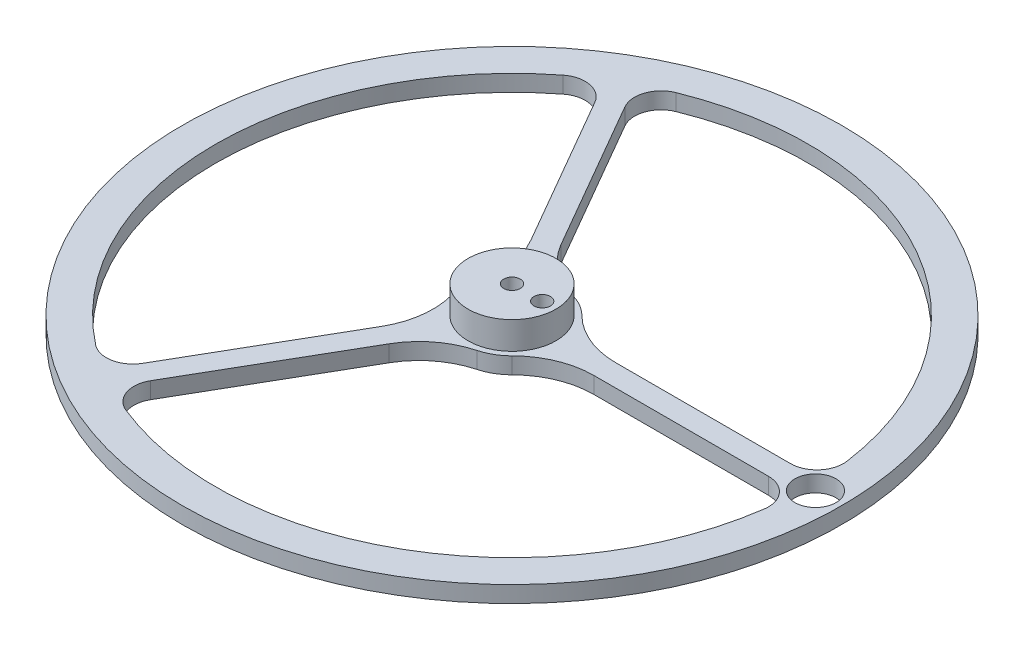
from build123d import *

# Parameters (mm, degrees)
SKETCH1_R               = 60
SKETCH1_R_2             = 54
BOSS_EXTRUDE1_DEPTH     = 3
SKETCH2_R               = 9
BOSS_EXTRUDE2_DEPTH     = 3
SKETCH3_R               = 8
BOSS_EXTRUDE3_DEPTH     = 5
BOSS_EXTRUDE4_DEPTH     = 3
CIRPATTERN9_COUNT       = 3
MIRROR2_COPY_1_DEPTH    = 3
MIRROR2_COPY_2_DEPTH    = 3
SKETCH5_R               = 1.5
CUT_EXTRUDE1_DEPTH      = 5
CUT_EXTRUDE2_DEPTH      = 86.229103011
CUT_EXTRUDE2_DEPTH_BACK = 86.229103011
SKETCH6_R               = 1.5
CUT_EXTRUDE3_DEPTH      = 86
CUT_EXTRUDE3_DEPTH_BACK = 86
SKETCH7_R               = 3.75


with BuildPart() as part:
    # Sketch1 → Boss-Extrude1 (new body)
    with BuildSketch(Plane(origin=(0, 0, 0), x_dir=(1, 0, 0), z_dir=(0, 1, 0))):
        with Locations(Location((0, 0, 0), (0, 0, 270))):
            Circle(SKETCH1_R)
        with Locations(Location((0, 0, 0), (0, 0, 270))):
            Circle(SKETCH1_R_2, mode=Mode.SUBTRACT)
    extrude(amount=BOSS_EXTRUDE1_DEPTH)



with BuildPart() as body_2:
    # Sketch2 → Boss-Extrude2 (new body)
    with BuildSketch(Plane(origin=(0, 0, 0), x_dir=(1, 0, 0), z_dir=(0, 1, 0))):
        with Locations(Location((0, 0, 0), (0, 0, 270))):
            Circle(SKETCH2_R)
    extrude(amount=BOSS_EXTRUDE2_DEPTH)

    # Sketch3 → Boss-Extrude3 (add)
    with BuildSketch(Plane(origin=(0, 3, 0), x_dir=(1, 0, 0), z_dir=(0, 1, 0))):
        with Locations(Location((0, 0, 0), (0, 0, 270))):
            Circle(SKETCH3_R)
    extrude(amount=BOSS_EXTRUDE3_DEPTH)


with BuildPart() as part_1:
    add(part.part)

    add(body_2.part)  # Boss-Extrude4 merges body 2
    # Sketch4 → Boss-Extrude4 (add)
    with BuildSketch(Plane(origin=(0, 0, 0), x_dir=(1, 0, 0), z_dir=(0, 1, 0))):
        with BuildLine():
            Line((9, 0), (54, 0))
            ThreePointArc((54, 0), (53.868998701, -3.759119436), (53.47663041, -7.5))
            ThreePointArc((53.47663041, -7.5), (52.338407888, -3.660460246), (48.694167528, -2))
            Line((48.694167528, -2), (16.899494937, -2))
            ThreePointArc((16.899494937, -2), (11.197705074, -3.13415652), (6.363961031, -6.363961031))
            ThreePointArc((6.363961031, -6.363961031), (8.314915793, -3.444150891), (9, 0))
        make_face()
    boss_extrude4 = extrude(amount=BOSS_EXTRUDE4_DEPTH)

    # CirPattern9: Boss-Extrude4 ×3 about axis
    cirpattern9_axis = Axis((0, 0, 0), (0, 1, 0))
    for i in range(1, CIRPATTERN9_COUNT):
        add(boss_extrude4.rotate(cirpattern9_axis, i * 360 / CIRPATTERN9_COUNT))

    # Mirror2: Boss-Extrude4 across plane
    add(boss_extrude4.mirror(Plane(origin=(-4.5, 54.446930959, -7.794228634), x_dir=(0.5000000000000041, 0, 0.8660254037844362), z_dir=(0.8660254037844364, 0, -0.5000000000000041))))

    # Mirror2 copy 1 sketch → Mirror2 copy 1 (add)
    with BuildSketch(Plane(origin=(0, 0, 0), x_dir=(-0.5000000000000082, 0, -0.8660254037844338), z_dir=(0, 1, 0))):
        with BuildLine():
            Line((9, 0), (54, 0))
            ThreePointArc((54, 0), (53.868998701, 3.759119436), (53.47663041, 7.5))
            ThreePointArc((53.47663041, 7.5), (52.338407888, 3.660460246), (48.694167528, 2))
            Line((48.694167528, 2), (16.899494937, 2))
            ThreePointArc((16.899494937, 2), (11.197705074, 3.13415652), (6.363961031, 6.363961031))
            ThreePointArc((6.363961031, 6.363961031), (8.314915793, 3.444150891), (9, 0))
        make_face()
    extrude(amount=MIRROR2_COPY_1_DEPTH)

    # Mirror2 copy 2 sketch → Mirror2 copy 2 (add)
    with BuildSketch(Plane(origin=(0, 0, 0), x_dir=(1, 0, 0), z_dir=(0, 1, 0))):
        with BuildLine():
            Line((9, 0), (54, 0))
            ThreePointArc((54, 0), (53.868998701, 3.759119436), (53.47663041, 7.5))
            ThreePointArc((53.47663041, 7.5), (52.338407888, 3.660460246), (48.694167528, 2))
            Line((48.694167528, 2), (16.899494937, 2))
            ThreePointArc((16.899494937, 2), (11.197705074, 3.13415652), (6.363961031, 6.363961031))
            ThreePointArc((6.363961031, 6.363961031), (8.314915793, 3.444150891), (9, 0))
        make_face()
    extrude(amount=MIRROR2_COPY_2_DEPTH)

    # Sketch5 → Cut-Extrude1 (cut)
    with BuildSketch(Plane(origin=(0, 8, 0), x_dir=(1, 0, 0), z_dir=(0, 1, 0))):
        with Locations(Location((5.5, 0, 0), (0, 0, 270))):
            Circle(SKETCH5_R)
    extrude(amount=-CUT_EXTRUDE1_DEPTH, mode=Mode.SUBTRACT)

    # Sketch6 → Cut-Extrude2 (cut, two sides: drawn at the far end of the back side and taken through both)
    with BuildSketch(Plane(origin=(0, 8, 0), x_dir=(1, 0, 0), z_dir=(0, 1, 0)).offset(-CUT_EXTRUDE2_DEPTH_BACK)):
        with Locations(Location((0, 0, 0), (0, 0, 270))):
            Circle(SKETCH6_R)
    extrude(amount=CUT_EXTRUDE2_DEPTH + CUT_EXTRUDE2_DEPTH_BACK, mode=Mode.SUBTRACT)

    # Sketch7 → Cut-Extrude3 (cut, two sides: drawn at the far end of the back side and taken through both)
    with BuildSketch(Plane(origin=(0, 3, 0), x_dir=(1, 0, 0), z_dir=(0, 1, 0)).offset(-CUT_EXTRUDE3_DEPTH_BACK)):
        with Locations(Location((55.25, 0, 0), (0, 0, 270))):
            Circle(SKETCH7_R)
    extrude(amount=CUT_EXTRUDE3_DEPTH + CUT_EXTRUDE3_DEPTH_BACK, mode=Mode.SUBTRACT)


solid = part_1.part
